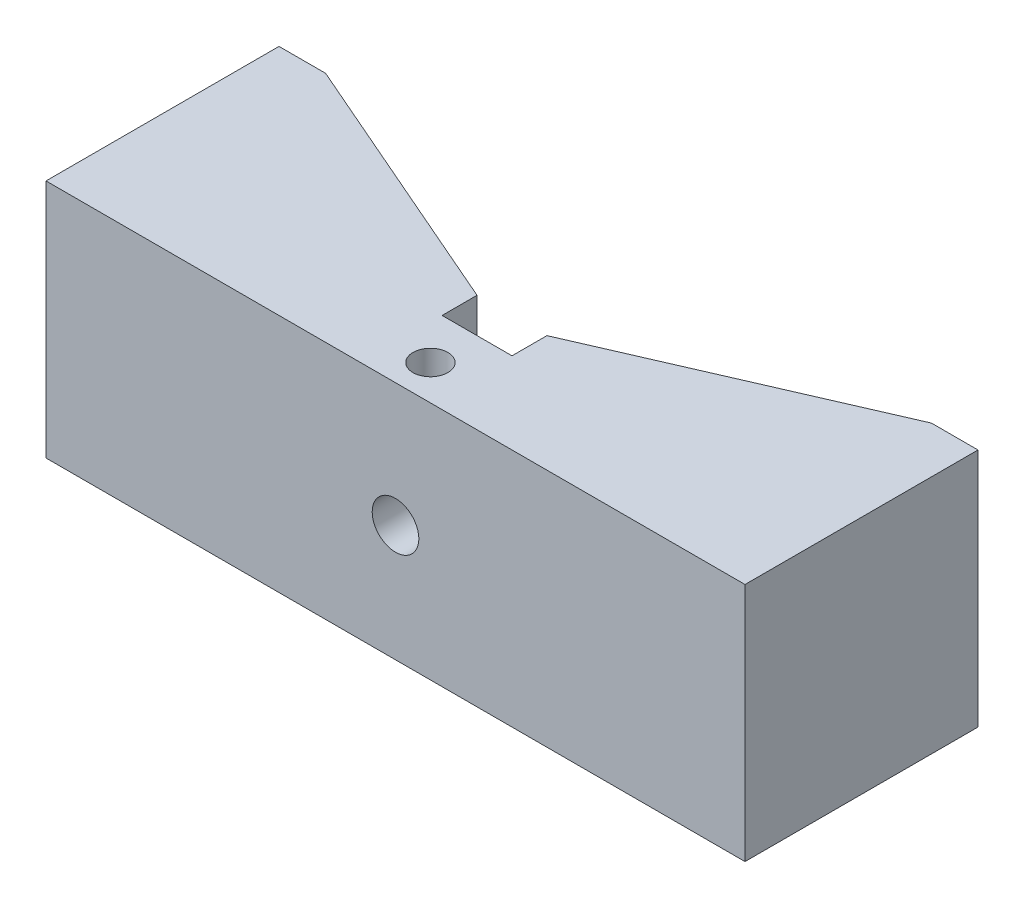
from build123d import *

# Parameters (mm, degrees)
BOSS_EXTRUDE1_DEPTH = 26.162
SKETCH3_R           = 1.905
CUT_EXTRUDE2_DEPTH  = 5.08
SKETCH2_R           = 2.54
CUT_EXTRUDE3_DEPTH  = 50.07790077


with BuildPart() as part:
    # Sketch1 → Boss-Extrude1 (new body)
    with BuildSketch(Plane(origin=(0, 0, 0), x_dir=(1, 0, 0), z_dir=(0, 1, 0))):
        Polygon((38.1, -12.7), (-38.1, -12.7), (-38.1, 12.7), (-33.02, 12.7), (-3.81, 0), (-3.81, -3.81), (3.81, -3.81), (3.81, 0), (33.02, 12.7), (38.1, 12.7), align=None)
    extrude(amount=BOSS_EXTRUDE1_DEPTH)

    # Sketch3 → Cut-Extrude2 (cut)
    with BuildSketch(Plane(origin=(0, 26.162, 0), x_dir=(1, 0, 0), z_dir=(0, 1, 0))):
        with Locations(Location((0, -8.89, 0), (0, 0, 270))):
            Circle(SKETCH3_R)
    extrude(amount=-CUT_EXTRUDE2_DEPTH, mode=Mode.SUBTRACT)

    # Sketch2 → Cut-Extrude3 (cut, through all)
    with BuildSketch(Plane(origin=(0, 0, 3.81), x_dir=(-1, 0, 0), z_dir=(0, 0, -1))):
        with Locations((0, 12.7)):
            Circle(SKETCH2_R)
    extrude(amount=-CUT_EXTRUDE3_DEPTH, mode=Mode.SUBTRACT)


solid = part.part
